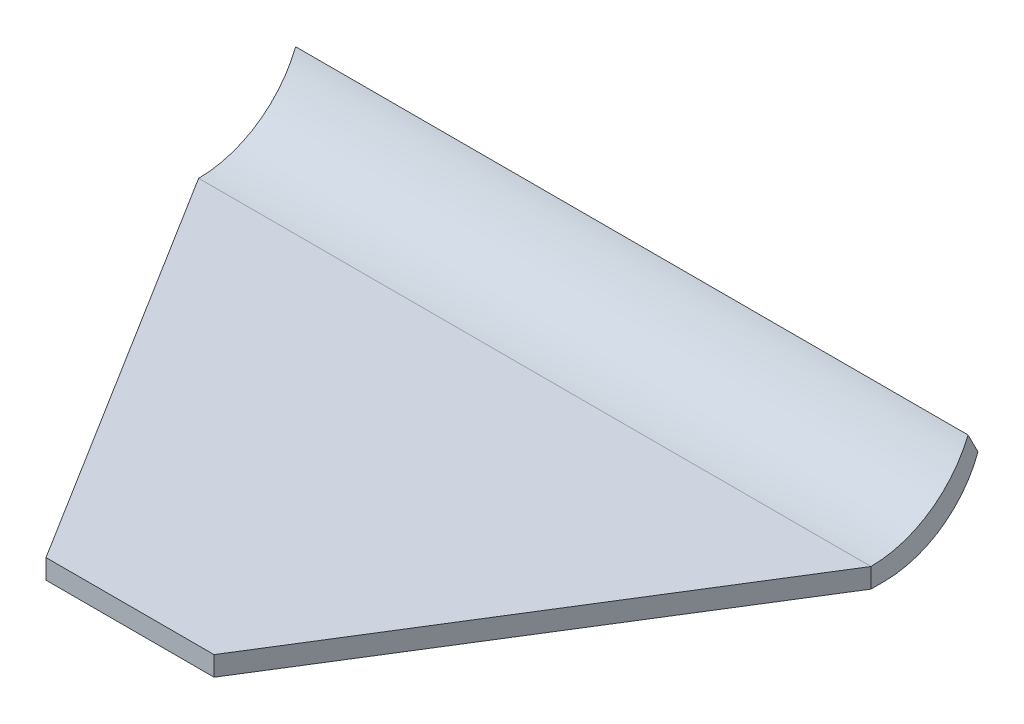
from build123d import *

# Parameters (mm, degrees)
BOSS_EXTRUDE2_DEPTH = 1200
CUT_EXTRUDE2_DEPTH  = 1200


with BuildPart() as part:
    # Sketch4 → Boss-Extrude2 (new body)
    with BuildSketch(Plane(origin=(0, 0, 0), x_dir=(0, 0, -1), z_dir=(1, 0, 0))):
        with BuildLine():
            Line((-418.085663079, -116.728740424), (-167.287455413, -116.728740424))
            ThreePointArc((-167.287455413, -116.728740424), (-65.293961038, -84.661970634), (0, 0))
            Line((0, 0), (-17.8, 35))
            ThreePointArc((-17.8, 35), (-86.57752002, -49.822987688), (-191.015585124, -81.728740424))
            Line((-191.015585124, -81.728740424), (-418.085663079, -81.728740424))
            Line((-418.085663079, -81.728740424), (-913.455403633, -81.728740424))
            Line((-913.455403633, -81.728740424), (-913.455403633, -116.728740424))
            Line((-913.455403633, -116.728740424), (-418.085663079, -116.728740424))
        make_face()
    extrude(amount=BOSS_EXTRUDE2_DEPTH)

    # Sketch5 → Cut-Extrude2 (cut)
    with BuildSketch(Plane(origin=(0, -81.728740424, 0), x_dir=(1, 0, 0), z_dir=(0, 1, 0))):
        Polygon((0, -913.455403633), (450, -913.455403633), (0, -191.015585124), align=None)
        Polygon((1200, -191.015585124), (750, -913.455403633), (1200, -913.455403633), align=None)
    extrude(amount=-CUT_EXTRUDE2_DEPTH, mode=Mode.SUBTRACT)


solid = part.part
